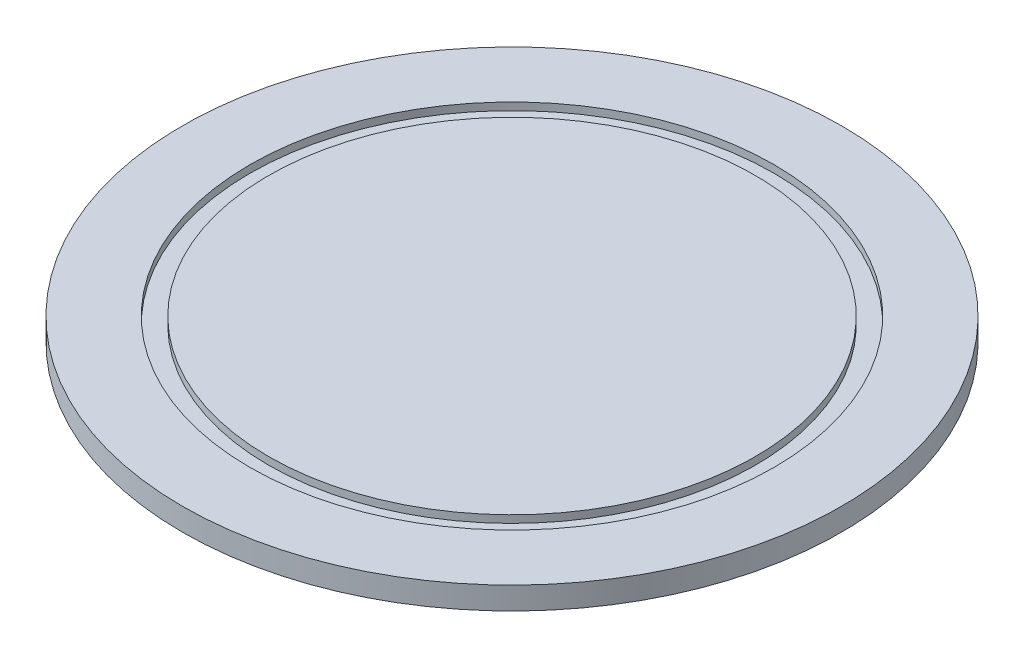
from build123d import *

# Parameters (mm, degrees)
SKETCH1_R           = 440
BOSS_EXTRUDE1_DEPTH = 15
SKETCH2_R           = 350
SKETCH2_R_2         = 325
CUT_EXTRUDE1_DEPTH  = 10


with BuildPart() as part:
    # Sketch1 → Boss-Extrude1 (new, symmetric)
    with BuildSketch(Plane(origin=(0, 0, 0), x_dir=(1, 0, 0), z_dir=(0, 1, 0))):
        with Locations(Location((0, 0, 0), (0, 0, 270))):
            Circle(SKETCH1_R)
    extrude(amount=BOSS_EXTRUDE1_DEPTH, both=True)

    # Sketch2 → Cut-Extrude1 (cut)
    with BuildSketch(Plane(origin=(0, 15, 0), x_dir=(1, 0, 0), z_dir=(0, 1, 0))):
        with Locations(Location((0, 0, 0), (0, 0, 270))):
            Circle(SKETCH2_R)
        with Locations(Location((0, 0, 0), (0, 0, 270))):
            Circle(SKETCH2_R_2, mode=Mode.SUBTRACT)
    extrude(amount=-CUT_EXTRUDE1_DEPTH, mode=Mode.SUBTRACT)


solid = part.part
